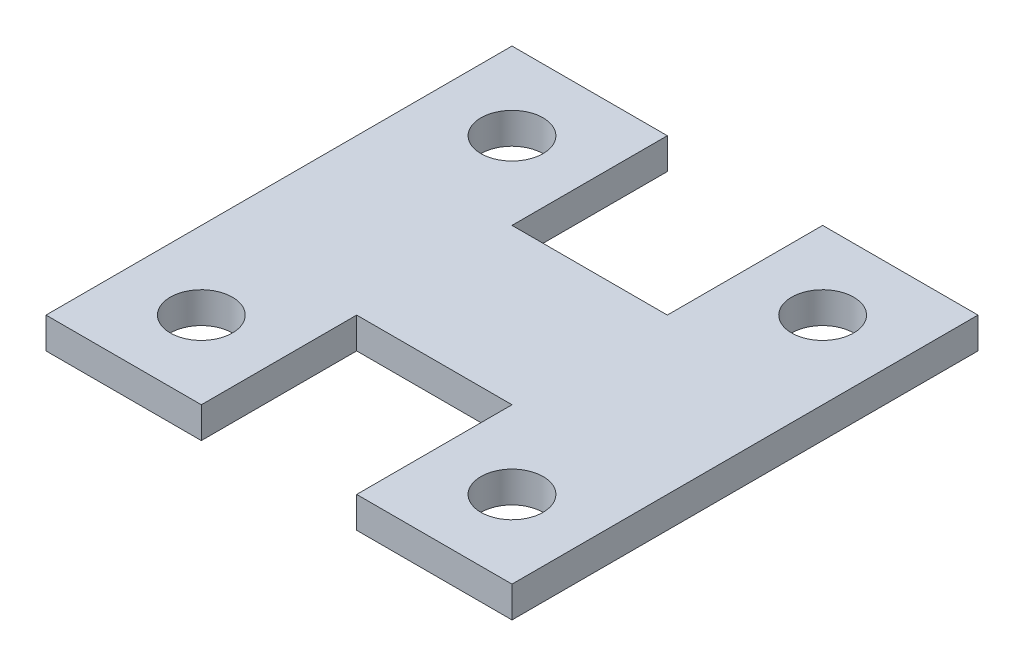
from build123d import *

# Parameters (mm, degrees)
SKETCH1_R           = 10
BOSS_EXTRUDE1_DEPTH = 10


with BuildPart() as part:
    # Sketch1 → Boss-Extrude1 (new body)
    with BuildSketch(Plane(origin=(0, 0, 0), x_dir=(1, 0, 0), z_dir=(0, 1, 0))):
        Polygon((25, 75), (75, 75), (75, -75), (25, -75), (25, -25), (-25, -25), (-25, -75), (-75, -75), (-75, 75), (-25, 75), (-25, 25), (25, 25), align=None)
        with Locations(Location((-50, 50, 0), (0, 0, 270))):
            Circle(SKETCH1_R, mode=Mode.SUBTRACT)
        with Locations(Location((50, 50, 0), (0, 0, 90))):
            Circle(SKETCH1_R, mode=Mode.SUBTRACT)
        with Locations(Location((50, -50, 0), (0, 0, 270))):
            Circle(SKETCH1_R, mode=Mode.SUBTRACT)
        with Locations(Location((-50, -50, 0), (0, 0, 90))):
            Circle(SKETCH1_R, mode=Mode.SUBTRACT)
    extrude(amount=BOSS_EXTRUDE1_DEPTH)


solid = part.part
